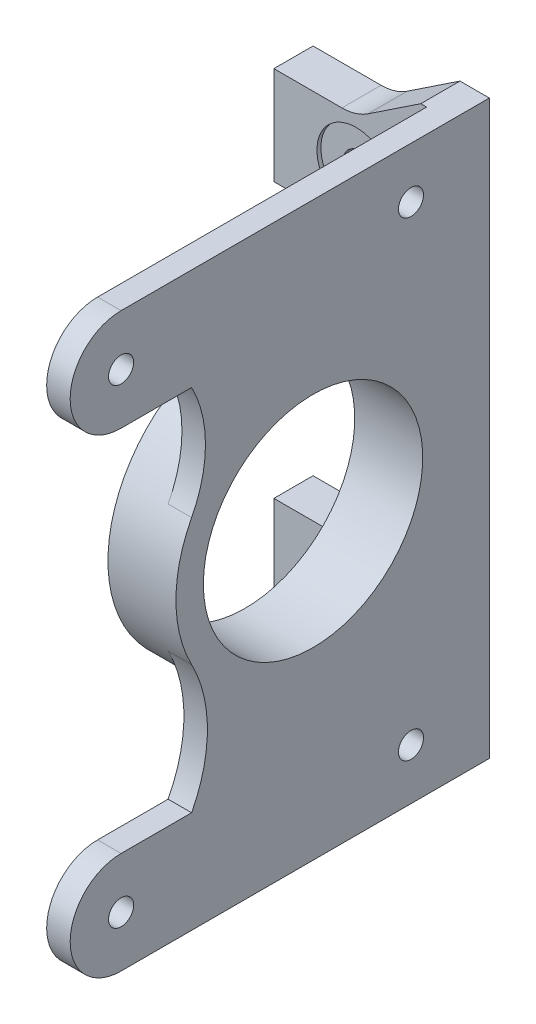
from build123d import *

# Parameters (mm, degrees)
EXTRUDE_2_DEPTH                = 5
SKETCH_4_W                     = 8.676470589
SKETCH_4_H                     = 35
SKETCH_4_W_2                   = 8.676470588
EXTRUDE_15_DEPTH               = 35
CUT_EXTRUDE_1_DEPTH            = 45
SKETCH_6_R                     = 14
CUT_EXTRUDE_2_DEPTH            = 45
FILLET_1_R                     = 5
SKETCH_7_R                     = 15
SKETCH_7_R_2                   = 13
EXTRUDE_16_DEPTH               = 1
SPLIT_BODIES_1_SURFACE_1_BACK  = 86
SPLIT_BODIES_1_SURFACE_1_DEPTH = 172
SPLIT_BODIES_1_SURFACE_2_BACK  = 86
SPLIT_BODIES_1_SURFACE_2_DEPTH = 172
SKETCH_17_W                    = 3
SKETCH_17_H                    = 13
EXTRUDE_20_DEPTH               = 42
EXTRUDE_21_DEPTH               = 3
SKETCH_19_R                    = 1.6
CUT_EXTRUDE_3_DEPTH            = 3
EXTRUDE_22_DEPTH               = 5
EXTRUDE_START                  = -3
EXTRUDE_25_DEPTH               = 3
HOLE_WIZARD_1_D                = 4.3
HOLE_WIZARD_1_DEPTH            = 5
HOLE_WIZARD_1_CBORE_D          = 10
HOLE_WIZARD_1_CBORE_DEPTH      = 0.5
HOLE_WIZARD_1_TIP              = 1.291850331
FILLET_2_R                     = 6


with BuildPart() as part:
    # 草图2 → 凸台-拉伸2 (new body)
    with BuildSketch(Plane.XY):
        Polygon((7.726423565, 24.338235294), (-14.773576435, 24.338235294), (-14.773576435, -35.661764706), (7.726423565, -35.661764706), (7.726423565, -23.161764706), (-6.097105846, -23.161764706), (-6.097105846, 11.838235294), (7.726423565, 11.838235294), align=None)
        Polygon((30.226423565, 24.338235294), (7.726423565, 24.338235294), (7.726423565, 11.838235294), (21.549952977, 11.838235294), (21.549952977, -23.161764706), (7.726423565, -23.161764706), (7.726423565, -35.661764706), (30.226423565, -35.661764706), align=None)
    extrude(amount=EXTRUDE_2_DEPTH)

    # 草图4 → 凸台-拉伸15 (add)
    with BuildSketch(Plane.XY.offset(5)):
        with Locations((-10.435341141, -5.661764706)):
            Rectangle(SKETCH_4_W, SKETCH_4_H)
        with Locations((25.888188271, -5.661764706)):
            Rectangle(SKETCH_4_W_2, SKETCH_4_H)
    extrude(amount=EXTRUDE_15_DEPTH)

    # 草图5 → 切除-拉伸1 (cut)
    with BuildSketch(Plane.ZY.offset(14.773576435)):
        with BuildLine():
            Line((40, -23.161764706), (40, -5.661764706))
            ThreePointArc((40, -5.661764706), (34.874368671, -18.036133377), (22.5, -23.161764706))
            Line((22.5, -23.161764706), (40, -23.161764706))
        make_face()
        with BuildLine():
            ThreePointArc((22.5, 11.838235294), (34.874368671, 6.712603965), (40, -5.661764706))
            Line((40, -5.661764706), (40, 11.838235294))
            Line((40, 11.838235294), (22.5, 11.838235294))
        make_face()
    extrude(amount=-CUT_EXTRUDE_1_DEPTH, mode=Mode.SUBTRACT)

    # 草图6 → 切除-拉伸2 (cut)
    with BuildSketch(Plane.ZY.offset(14.773576435)):
        with Locations((22.5, -5.661764706)):
            Circle(SKETCH_6_R)
    extrude(amount=-CUT_EXTRUDE_2_DEPTH, mode=Mode.SUBTRACT)

    # 圆角1
    fillet_1_edges = [part.edges().sort_by_distance(p)[0] for p in [
        (-6.097105846, 11.838235294, 2.5),
        (-6.097105846, -23.161764706, 2.5),
        (21.549952977, -23.161764706, 2.5),
        (21.549952977, 11.838235294, 2.5),
    ]]
    fillet(fillet_1_edges, radius=FILLET_1_R)

    # 草图7 → 凸台-拉伸16 (add)
    with BuildSketch(Plane(origin=(-6.097105846, 0, 0), x_dir=(0, 0, -1), z_dir=(1, 0, 0))):
        with Locations((-22.5, -5.661764706)):
            Circle(SKETCH_7_R)
        with Locations((-22.5, -5.661764706)):
            Circle(SKETCH_7_R_2, mode=Mode.SUBTRACT)
    extrude(amount=-EXTRUDE_16_DEPTH)


with BuildPart() as body_2:
    # Split Bodies 1: the piece behind the surface
    add(part.part)
    # Split Bodies 1 surface: a surface, the sketch's curves swept straight by 172 mm
    with BuildLine(Plane.XY.offset(5).offset(-SPLIT_BODIES_1_SURFACE_1_BACK), mode=Mode.PRIVATE) as split_bodies_1_surface_1_path:
        Line((7.726423565, 24.338235294), (7.726423565, -35.661764706))
    split_bodies_1_surface_1 = Shell.extrude(split_bodies_1_surface_1_path.wire(), (0 * SPLIT_BODIES_1_SURFACE_1_DEPTH, 0 * SPLIT_BODIES_1_SURFACE_1_DEPTH, 1 * SPLIT_BODIES_1_SURFACE_1_DEPTH))
    split(bisect_by=split_bodies_1_surface_1, keep=Keep.BOTTOM)


with BuildPart() as part_1:
    add(part.part)

    # Split Bodies 1: split by a surface, the side it looks to stays
    # Split Bodies 1 surface: a surface, the sketch's curves swept straight by 172 mm
    with BuildLine(Plane.XY.offset(5).offset(-SPLIT_BODIES_1_SURFACE_2_BACK), mode=Mode.PRIVATE) as split_bodies_1_surface_2_path:
        Line((7.726423565, 24.338235294), (7.726423565, -35.661764706))
    split_bodies_1_surface_2 = Shell.extrude(split_bodies_1_surface_2_path.wire(), (0 * SPLIT_BODIES_1_SURFACE_2_DEPTH, 0 * SPLIT_BODIES_1_SURFACE_2_DEPTH, 1 * SPLIT_BODIES_1_SURFACE_2_DEPTH))
    split(bisect_by=split_bodies_1_surface_2, keep=Keep.TOP)

    # 草图17 → 凸台-拉伸20 (add)
    with BuildSketch(Plane.XY.offset(5)):
        with Locations((28.726423565, -36.661764706)):
            Rectangle(SKETCH_17_W, SKETCH_17_H)
        with Locations((28.726423565, 23.338235294)):
            Rectangle(SKETCH_17_W, SKETCH_17_H)
    extrude(amount=EXTRUDE_20_DEPTH)

    # 草图18 → 凸台-拉伸21 (add)
    with BuildSketch(Plane(origin=(30.226423565, 0, 0), x_dir=(0, 0, -1), z_dir=(1, 0, 0))):
        with BuildLine():
            Line((-47, -30.161764706), (-47, -43.161764706))
            ThreePointArc((-47, -43.161764706), (-53.5, -36.661764706), (-47, -30.161764706))
        make_face()
        with BuildLine():
            Line((-47, 16.838235294), (-47, 29.838235294))
            ThreePointArc((-47, 29.838235294), (-53.5, 23.338235294), (-47, 16.838235294))
        make_face()
    extrude(amount=-EXTRUDE_21_DEPTH)

    # 草图19 → 切除-拉伸3 (cut)
    with BuildSketch(Plane(origin=(30.226423565, 0, 0), x_dir=(0, 0, -1), z_dir=(1, 0, 0))):
        with Locations((-47, 23.338235294)):
            Circle(SKETCH_19_R)
        with Locations((-47, -36.661764706)):
            Circle(SKETCH_19_R)
        with Locations((-10, 23.338235294)):
            Circle(SKETCH_19_R)
        with Locations((-10, -36.661764706)):
            Circle(SKETCH_19_R)
    extrude(amount=-CUT_EXTRUDE_3_DEPTH, mode=Mode.SUBTRACT)

    # 草图21 → 凸台-拉伸22 (add)
    with BuildSketch(Plane.XY.offset(5)):
        Polygon((18.226423565, -35.661764706), (30.226423565, -35.661764706), (30.226423565, -43.161764706), (27.226423565, -43.161764706), (26.408241747, -43.161764706), align=None)
        Polygon((18.226423565, 24.338235294), (30.226423565, 24.338235294), (30.226423565, 29.838235294), (26.476423565, 29.838235294), align=None)
    extrude(amount=-EXTRUDE_22_DEPTH)

    # 草图24 → 凸台-拉伸25 (add)
    with BuildSketch(Plane(origin=(30.226423565, 0, 0), x_dir=(0, 0, -1), z_dir=(1, 0, 0)).offset(EXTRUDE_START)):
        with BuildLine():
            Line((-5, 16.838235294), (-38, 16.838235294))
            ThreePointArc((-38, 16.838235294), (-36.230441453, 9.650254496), (-38, 2.462273699))
            ThreePointArc((-38, 2.462273699), (-31.557574949, 9.311890026), (-22.5, 11.838235294))
            Line((-22.5, 11.838235294), (-5, 11.838235294))
            Line((-5, 11.838235294), (-5, 16.838235294))
        make_face()
        with BuildLine():
            Line((-5, -30.161764706), (-38, -30.161764706))
            ThreePointArc((-38, -30.161764706), (-35.984258471, -21.973783908), (-38, -13.785803111))
            ThreePointArc((-38, -13.785803111), (-31.557574949, -20.635419438), (-22.5, -23.161764706))
            Line((-22.5, -23.161764706), (-5, -23.161764706))
            Line((-5, -23.161764706), (-5, -30.161764706))
        make_face()
    extrude(amount=EXTRUDE_25_DEPTH)

    # 打孔尺寸(%根据六角头螺)栓 全螺纹的类型1
    with Locations(Plane(origin=(18.226423565, 18.088235294, 5), x_dir=(1, 0, 0), z_dir=(0, 0, 1))):
        with Locations((0, 0), (0, -47.5)):
            CounterBoreHole(HOLE_WIZARD_1_D / 2, HOLE_WIZARD_1_CBORE_D / 2, HOLE_WIZARD_1_CBORE_DEPTH, depth=HOLE_WIZARD_1_DEPTH)
            with Locations((0, 0, -(HOLE_WIZARD_1_DEPTH + HOLE_WIZARD_1_TIP / 2))):  # 118° drill point
                Cone(0, HOLE_WIZARD_1_D / 2, HOLE_WIZARD_1_TIP, mode=Mode.SUBTRACT)

    # 圆角2
    fillet_2_edges = [part_1.edges().sort_by_distance(p)[0] for p in [
        (18.226423565, -35.661764706, 2.5),
        (18.226423565, 24.338235294, 2.5),
    ]]
    fillet(fillet_2_edges, radius=FILLET_2_R)


solid = part_1.part
